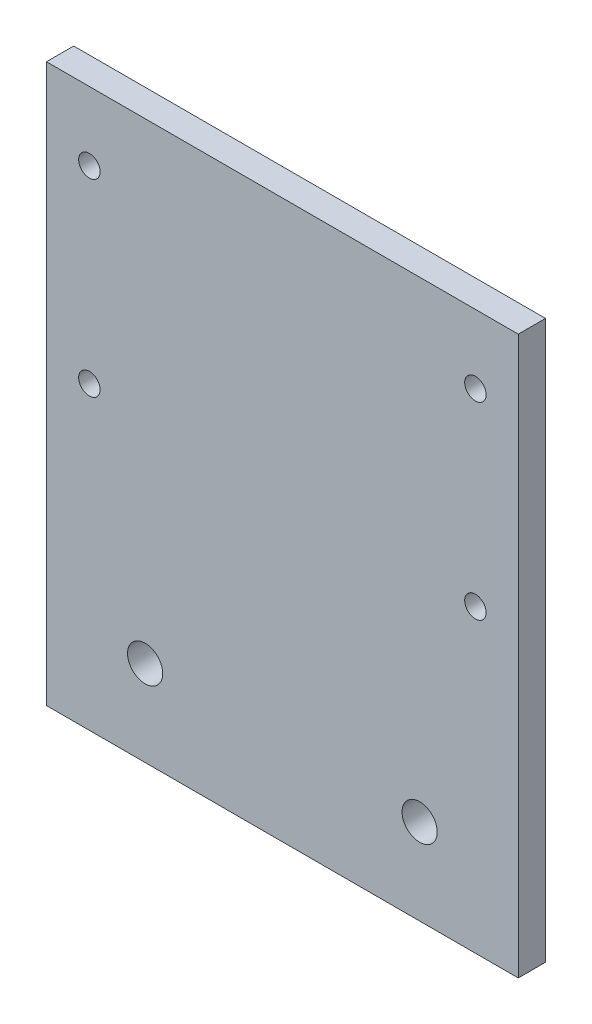
from build123d import *

# Parameters (mm, degrees)
SKETCH1_W           = 55
SKETCH1_H           = 65
SKETCH1_R           = 1.25
SKETCH1_R_2         = 2.05
BOSS_EXTRUDE1_DEPTH = 3.175


with BuildPart() as part:
    # Sketch1 → Boss-Extrude1 (new body)
    with BuildSketch(Plane.XY):
        with Locations((27.5, 32.5)):
            Rectangle(SKETCH1_W, SKETCH1_H)
        with Locations((5, 57)):
            Circle(SKETCH1_R, mode=Mode.SUBTRACT)
        with Locations((50, 57)):
            Circle(SKETCH1_R, mode=Mode.SUBTRACT)
        with Locations((50, 35)):
            Circle(SKETCH1_R, mode=Mode.SUBTRACT)
        with Locations((5, 35)):
            Circle(SKETCH1_R, mode=Mode.SUBTRACT)
        with Locations((11.5, 10)):
            Circle(SKETCH1_R_2, mode=Mode.SUBTRACT)
        with Locations((43.5, 10)):
            Circle(SKETCH1_R_2, mode=Mode.SUBTRACT)
    extrude(amount=BOSS_EXTRUDE1_DEPTH)


solid = part.part
